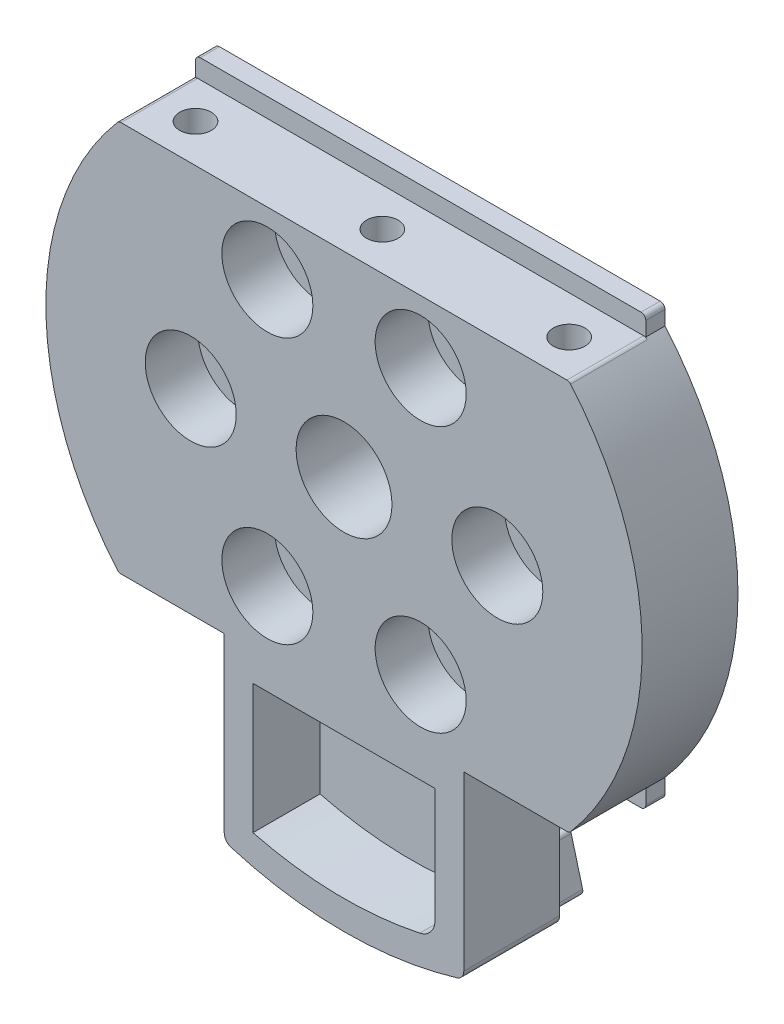
from build123d import *

# Parameters (mm, degrees)
EXTRUDE_1_DEPTH              = 2
SKETCH_2_W                   = 11
SKETCH_2_H                   = 2
CUT_EXTRUDE_1_DEPTH          = 16.753033088
SKETCH_3_W                   = 11
SKETCH_3_H                   = 2
CUT_EXTRUDE_2_DEPTH          = 16.753033088
EXTRUDE_2_DEPTH              = 8
SKETCH_5_W                   = 47
SKETCH_5_H                   = 2
EXTRUDE_3_DEPTH              = 2
EXTRUDE_START                = 4.4
EXTRUDE_4_DEPTH              = 4.4
CUT_EXTRUDE_3_DEPTH          = 7
HOLE_WIZARD_3_3_3_3_1_D      = 3.3
HOLE_WIZARD_3_3_3_3_1_DEPTH  = 11.5
HOLE_WIZARD_3_3_3_3_1_TIP    = 0.991420021
HOLE_WIZARD_3_3_3_3_2_D      = 3.3
HOLE_WIZARD_3_3_3_3_2_DEPTH  = 11.5
HOLE_WIZARD_3_3_3_3_2_TIP    = 0.991420021
HOLE_WIZARD_10_0_10_1_D      = 10
HOLE_WIZARD_M5_1_D           = 5.5
HOLE_WIZARD_M5_1_DEPTH       = 14.4
HOLE_WIZARD_M5_1_CBORE_D     = 9.5
HOLE_WIZARD_M5_1_CBORE_DEPTH = 5.5
FILLET_1_R                   = 0.5
FILLET_2_R                   = 1
FILLET_4_R                   = 2


with BuildPart() as part:
    # 草图1 → 凸台-拉伸1 (new body)
    with BuildSketch(Plane(origin=(0, 0, 0), x_dir=(-1, 0, 0), z_dir=(0, 0, -1))):
        with BuildLine():
            Line((12.5, -39.153033088), (23.5, -39.153033088))
            Line((23.5, -39.153033088), (23.5, -20.4))
            ThreePointArc((23.5, -20.4), (31.119286624, 0), (23.5, 20.4))
            Line((23.5, 20.4), (-23.5, 20.4))
            ThreePointArc((-23.5, 20.4), (-31.119286624, 0), (-23.5, -20.4))
            Line((-23.5, -20.4), (-23.5, -39.153033088))
            Line((-23.5, -39.153033088), (-12.5, -39.153033088))
            ThreePointArc((-12.5, -39.153033088), (0, -41.1), (12.5, -39.153033088))
        make_face()
    extrude(amount=-EXTRUDE_1_DEPTH)

    # 草图2 → 切除-拉伸1 (cut)
    with BuildSketch(Plane.XZ.offset(39.153033088)):
        with Locations((-18, 1)):
            Rectangle(SKETCH_2_W, SKETCH_2_H)
    extrude(amount=-CUT_EXTRUDE_1_DEPTH, mode=Mode.SUBTRACT)

    # 草图3 → 切除-拉伸2 (cut)
    with BuildSketch(Plane.XZ.offset(39.153033088)):
        with Locations((18, 1)):
            Rectangle(SKETCH_3_W, SKETCH_3_H)
    extrude(amount=-CUT_EXTRUDE_2_DEPTH, mode=Mode.SUBTRACT)

    # 草图4 → 凸台-拉伸2 (add)
    with BuildSketch(Plane.XY.offset(2)):
        with BuildLine():
            Line((-12.5, -39.153033088), (-12.5, -20.4))
            Line((-12.5, -20.4), (-23.5, -20.4))
            ThreePointArc((-23.5, -20.4), (-31.119286624, 0), (-23.5, 20.4))
            Line((-23.5, 20.4), (23.5, 20.4))
            ThreePointArc((23.5, 20.4), (31.119286624, 0), (23.5, -20.4))
            Line((23.5, -20.4), (12.5, -20.4))
            Line((12.5, -20.4), (12.5, -39.153033088))
            ThreePointArc((12.5, -39.153033088), (0, -41.1), (-12.5, -39.153033088))
        make_face()
    extrude(amount=EXTRUDE_2_DEPTH)

    # 草图5 → 凸台-拉伸3 (add)
    with BuildSketch(Plane(origin=(0, 20.4, 0), x_dir=(-1, 0, 0), z_dir=(0, 1, 0))):
        with Locations((0, 1)):
            Rectangle(SKETCH_5_W, SKETCH_5_H)
    extrude(amount=EXTRUDE_3_DEPTH)

    # 草图6 → 凸台-拉伸4 (add)
    with BuildSketch(Plane(origin=(0, 0, 0), x_dir=(-1, 0, 0), z_dir=(0, 0, -1)).offset(EXTRUDE_START)):
        with BuildLine():
            Line((9.188076101, -34.290366833), (10.637462754, -39.69955146))
            ThreePointArc((10.637462754, -39.69955146), (0, -41.1), (-10.637462754, -39.69955146))
            Line((-10.637462754, -39.69955146), (-9.188076101, -34.290366833))
            ThreePointArc((-9.188076101, -34.290366833), (0, -35.5), (9.188076101, -34.290366833))
        make_face()
    extrude(amount=-EXTRUDE_4_DEPTH)

    # 草图7 → 切除-拉伸3 (cut)
    with BuildSketch(Plane.XY.offset(10)):
        with BuildLine():
            Line((9.5, -36.896612311), (9.5, -23.4))
            Line((9.5, -23.4), (-9.5, -23.4))
            Line((-9.5, -23.4), (-9.5, -36.896612311))
            ThreePointArc((-9.5, -36.896612311), (0, -38.1), (9.5, -36.896612311))
        make_face()
    extrude(amount=-CUT_EXTRUDE_3_DEPTH, mode=Mode.SUBTRACT)

    # Ø3.3 (3.3) 直径孔1
    with Locations(Plane(origin=(0, 20.4, 0), x_dir=(1, 0, 0), z_dir=(0, 1, 0))):
        with Locations((-19.5, -6), (19.5, -6), (0, -6)):
            Hole(HOLE_WIZARD_3_3_3_3_1_D / 2, depth=HOLE_WIZARD_3_3_3_3_1_DEPTH)
            with Locations((0, 0, -(HOLE_WIZARD_3_3_3_3_1_DEPTH + HOLE_WIZARD_3_3_3_3_1_TIP / 2))):  # 118° drill point
                Cone(0, HOLE_WIZARD_3_3_3_3_1_D / 2, HOLE_WIZARD_3_3_3_3_1_TIP, mode=Mode.SUBTRACT)

    # Ø3.3 (3.3) 直径孔2
    with Locations(Plane.XZ.offset(20.4)):
        with Locations((-19.5, -6), (-19.5, 6)):
            Hole(HOLE_WIZARD_3_3_3_3_2_D / 2, depth=HOLE_WIZARD_3_3_3_3_2_DEPTH)
            with Locations((0, 0, -(HOLE_WIZARD_3_3_3_3_2_DEPTH + HOLE_WIZARD_3_3_3_3_2_TIP / 2))):  # 118° drill point
                Cone(0, HOLE_WIZARD_3_3_3_3_2_D / 2, HOLE_WIZARD_3_3_3_3_2_TIP, mode=Mode.SUBTRACT)

    # Ø10.0 (10) 直径孔1 (through all)
    with Locations(Plane(origin=(0, 0, 0), x_dir=(-1, 0, 0), z_dir=(0, 0, -1))):
        with Locations((0, 0)):
            Hole(HOLE_WIZARD_10_0_10_1_D / 2)

    # M5 六角头螺栓的柱形沉头孔1
    with Locations(Plane.XY.offset(10)):
        with Locations((16, 0), (8, -13.856406461), (-8, -13.856406461), (-16, 0), (-8, 13.856406461), (8, 13.856406461)):
            CounterBoreHole(HOLE_WIZARD_M5_1_D / 2, HOLE_WIZARD_M5_1_CBORE_D / 2, HOLE_WIZARD_M5_1_CBORE_DEPTH, depth=HOLE_WIZARD_M5_1_DEPTH)

    # 圆角1
    fillet_1_edges = [part.edges().sort_by_distance(p)[0] for p in [
        (23.5, 20.4, 6),
        (-23.5, 20.4, 6),
        (-23.5, -22.4, 1),
        (23.5, -22.4, 1),
        (23.5, -20.4, 6),
        (-23.5, -20.4, 6),
        (23.5, 22.4, 1),
        (-23.5, 22.4, 1),
        (-9.188076101, -34.290366833, -2.2),
        (9.188076101, -34.290366833, -2.2),
        (10.637462754, -39.69955146, -2.2),
        (-10.637462754, -39.69955146, -2.2),
    ]]
    fillet(fillet_1_edges, radius=FILLET_1_R)

    # 圆角2
    fillet_2_edges = [part.edges().sort_by_distance(p)[0] for p in [
        (12.5, -39.153033088, 5),
        (-12.5, -39.153033088, 5),
    ]]
    fillet(fillet_2_edges, radius=FILLET_2_R)

    # 圆角4
    fillet_4_edges = [part.edges().sort_by_distance(p)[0] for p in [
        (9.5, -36.896612311, 6.5),
    ]]
    fillet(fillet_4_edges, radius=FILLET_4_R)


solid = part.part
